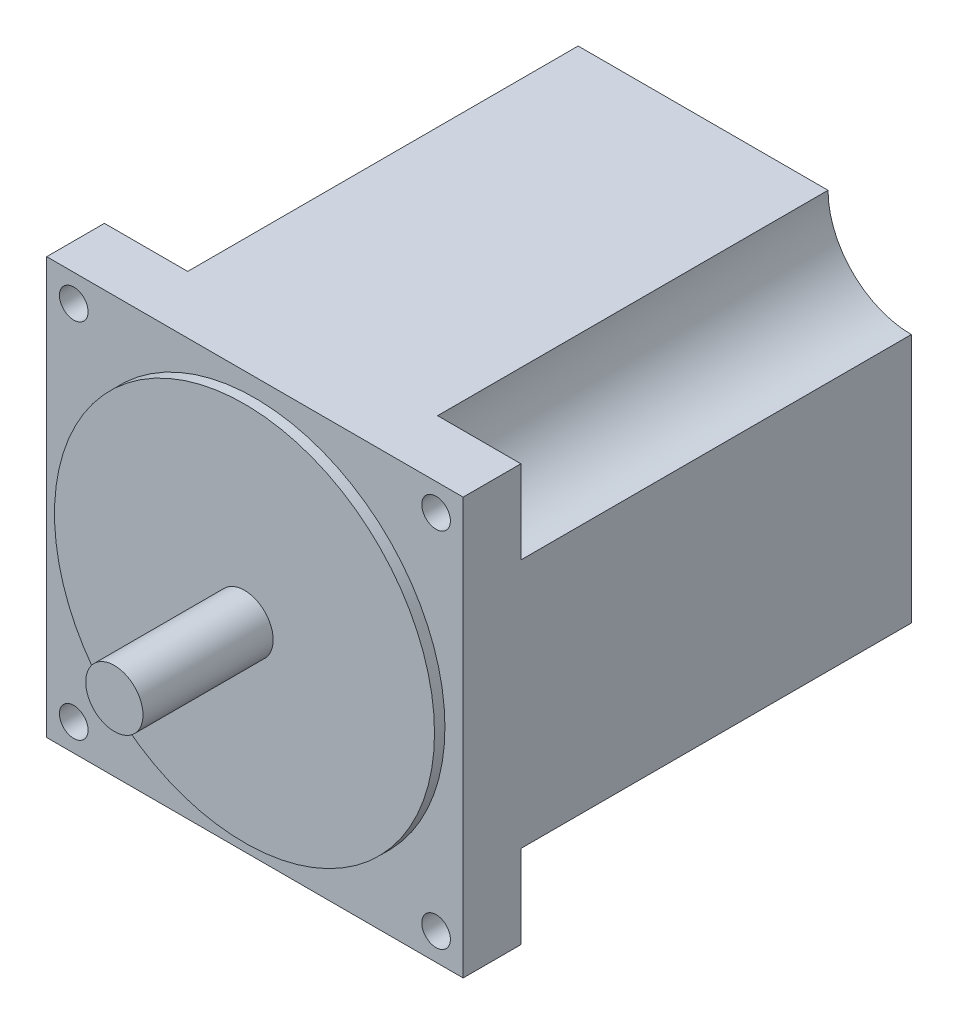
from build123d import *

# Parameters (mm, degrees)
SKETCH2_W           = 80
SKETCH2_H           = 80
BOSS_EXTRUDE1_DEPTH = 86.09
SKETCH3_R           = 2.75
CUT_EXTRUDE1_DEPTH  = 104.012077447
SKETCH4_R           = 36.5
BOSS_EXTRUDE2_DEPTH = 2
SKETCH5_R           = 5.5
BOSS_EXTRUDE3_DEPTH = 25
CUT_EXTRUDE2_START  = -75
SKETCH6_R           = 2.75
CUT_EXTRUDE2_DEPTH  = 75
SKETCH7_R           = 4.006
BOSS_EXTRUDE4_DEPTH = 13.5


with BuildPart() as part:
    # Sketch2 → Boss-Extrude1 (new body)
    with BuildSketch(Plane.XY):
        Rectangle(SKETCH2_W, SKETCH2_H)
    extrude(amount=BOSS_EXTRUDE1_DEPTH)

    # Sketch3 → Cut-Extrude1 (cut, through all)
    with BuildSketch(Plane.XY.offset(86.09)):
        with Locations((-34.8, 34.8)):
            Circle(SKETCH3_R)
        with Locations((34.8, 34.8)):
            Circle(SKETCH3_R)
        with Locations((-34.8, -34.8)):
            Circle(SKETCH3_R)
        with Locations((34.8, -34.8)):
            Circle(SKETCH3_R)
    extrude(amount=-CUT_EXTRUDE1_DEPTH, mode=Mode.SUBTRACT)

    # Sketch4 → Boss-Extrude2 (add)
    with BuildSketch(Plane.XY.offset(86.09)):
        Circle(SKETCH4_R)
    extrude(amount=BOSS_EXTRUDE2_DEPTH)

    # Sketch5 → Boss-Extrude3 (add)
    with BuildSketch(Plane.XY.offset(88.09)):
        Circle(SKETCH5_R)
    extrude(amount=BOSS_EXTRUDE3_DEPTH)

    # Sketch6 → Cut-Extrude2 (cut)
    # profile 1 of 4: a face of its own
    with BuildSketch(Plane(origin=(0, 0, 0), x_dir=(-1, 0, 0), z_dir=(0, 0, -1)).offset(CUT_EXTRUDE2_START)):
        with BuildLine():
            Line((-40, 40), (-40, 24))
            ThreePointArc((-40, 24), (-28.686291501, 28.686291501), (-24, 40))
            Line((-24, 40), (-40, 40))
        make_face()
        with Locations(Location((-34.8, 34.8, 0), (0, 0, 180))):
            Circle(SKETCH6_R, mode=Mode.SUBTRACT)
    # profile 2 of 4: a face of its own
    with BuildSketch(Plane(origin=(0, 0, 0), x_dir=(-1, 0, 0), z_dir=(0, 0, -1)).offset(CUT_EXTRUDE2_START)):
        with BuildLine():
            ThreePointArc((24, 40), (28.686291501, 28.686291501), (40, 24))
            Line((40, 24), (40, 40))
            Line((40, 40), (24, 40))
        make_face()
        with Locations(Location((34.8, 34.8, 0), (0, 0, 180))):
            Circle(SKETCH6_R, mode=Mode.SUBTRACT)
    # profile 3 of 4: a face of its own
    with BuildSketch(Plane(origin=(0, 0, 0), x_dir=(-1, 0, 0), z_dir=(0, 0, -1)).offset(CUT_EXTRUDE2_START)):
        with BuildLine():
            Line((24, -40), (40, -40))
            Line((40, -40), (40, -24))
            ThreePointArc((40, -24), (28.686291501, -28.686291501), (24, -40))
        make_face()
        with Locations(Location((34.8, -34.8, 0), (0, 0, 180))):
            Circle(SKETCH6_R, mode=Mode.SUBTRACT)
    # profile 4 of 4: a face of its own
    with BuildSketch(Plane(origin=(0, 0, 0), x_dir=(-1, 0, 0), z_dir=(0, 0, -1)).offset(CUT_EXTRUDE2_START)):
        with BuildLine():
            Line((-40, -40), (-24, -40))
            ThreePointArc((-24, -40), (-28.686291501, -28.686291501), (-40, -24))
            Line((-40, -24), (-40, -40))
        make_face()
        with Locations(Location((-34.8, -34.8, 0), (0, 0, 180))):
            Circle(SKETCH6_R, mode=Mode.SUBTRACT)
    extrude(amount=CUT_EXTRUDE2_DEPTH, mode=Mode.SUBTRACT)

    # Sketch7 → Boss-Extrude4 (add)
    with BuildSketch(Plane(origin=(0, 0, 0), x_dir=(-1, 0, 0), z_dir=(0, 0, -1))):
        with Locations(Location((0, 0, 0), (0, 0, 180))):
            Circle(SKETCH7_R)
    extrude(amount=BOSS_EXTRUDE4_DEPTH)


solid = part.part
